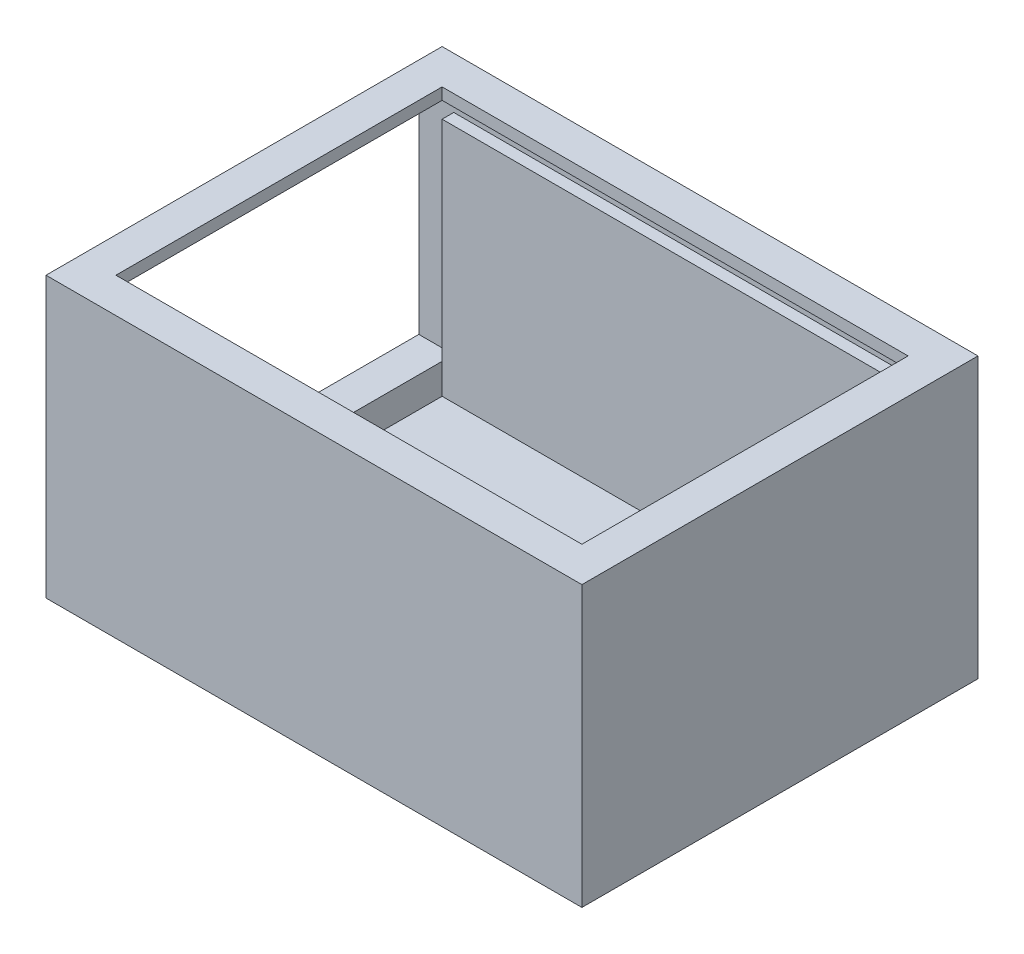
from build123d import *

# Parameters (mm, degrees)
SKETCH1_W           = 115
SKETCH1_H           = 85
BOSS_EXTRUDE1_DEPTH = 60
SKETCH2_W           = 100
SKETCH2_H           = 70
CUT_EXTRUDE1_DEPTH  = 57.5
SKETCH3_W           = 75
SKETCH3_H           = 3.5
CUT_EXTRUDE2_DEPTH  = 109
SKETCH4_W           = 74.99639209
SKETCH4_H           = 45
CUT_EXTRUDE3_DEPTH  = 7.5


with BuildPart() as part:
    # Sketch1 → Boss-Extrude1 (new body)
    with BuildSketch(Plane(origin=(0, 0, 0), x_dir=(1, 0, 0), z_dir=(0, 1, 0))):
        with Locations((57.5, 42.5)):
            Rectangle(SKETCH1_W, SKETCH1_H)
    extrude(amount=BOSS_EXTRUDE1_DEPTH)

    # Sketch2 → Cut-Extrude1 (cut)
    with BuildSketch(Plane(origin=(0, 60, 0), x_dir=(1, 0, 0), z_dir=(0, 1, 0))):
        with Locations((57.5, 42.5)):
            Rectangle(SKETCH2_W, SKETCH2_H)
    extrude(amount=-CUT_EXTRUDE1_DEPTH, mode=Mode.SUBTRACT)

    # Sketch3 → Cut-Extrude2 (cut)
    with BuildSketch(Plane.ZY):
        with Locations((-42.5, 55.75)):
            Rectangle(SKETCH3_W, SKETCH3_H)
    extrude(amount=-CUT_EXTRUDE2_DEPTH, mode=Mode.SUBTRACT)

    # Sketch4 → Cut-Extrude3 (cut)
    with BuildSketch(Plane.ZY):
        with Locations((-42.501803955, 31.5)):
            Rectangle(SKETCH4_W, SKETCH4_H)
    extrude(amount=-CUT_EXTRUDE3_DEPTH, mode=Mode.SUBTRACT)


solid = part.part
